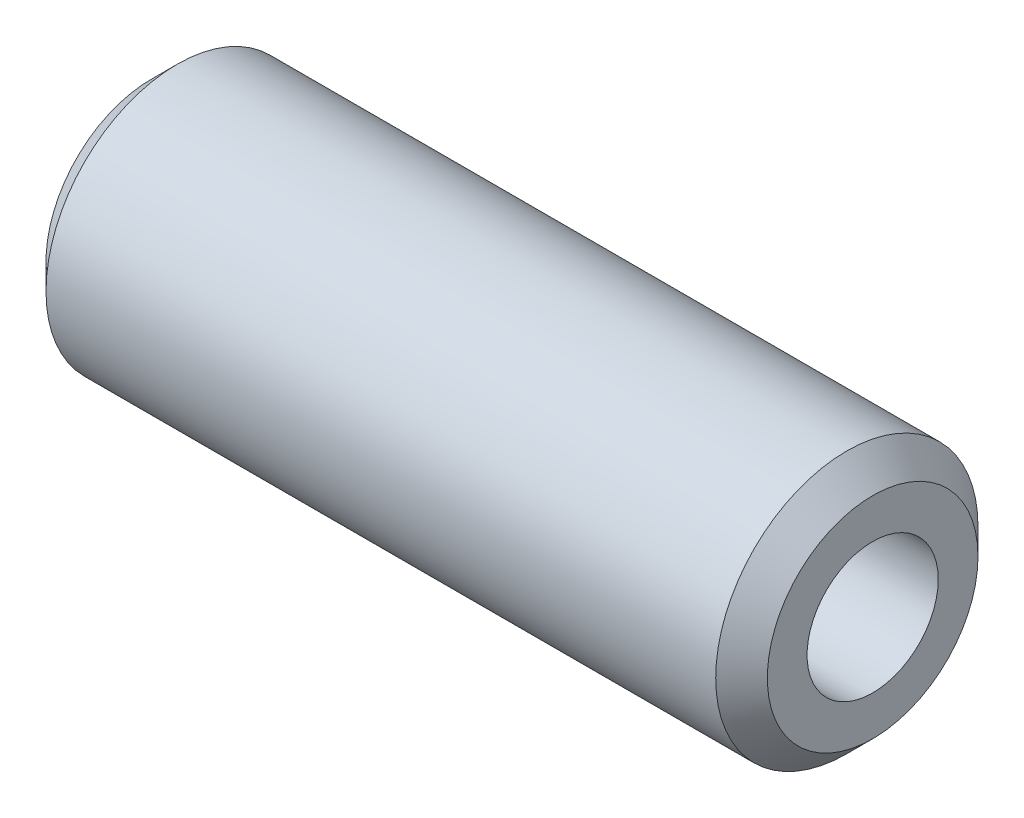
from build123d import *

# Parameters (mm, degrees)
SKETCH1_R           = 12.7
SKETCH1_R_2         = 6.35
BOSS_EXTRUDE1_DEPTH = 69.85
CHAMFER1_SIZE       = 2.5


with BuildPart() as part:
    # Sketch1 → Boss-Extrude1 (new body)
    with BuildSketch(Plane(origin=(0, 0, 0), x_dir=(0, 0, -1), z_dir=(1, 0, 0))):
        Circle(SKETCH1_R)
        Circle(SKETCH1_R_2, mode=Mode.SUBTRACT)
    extrude(amount=BOSS_EXTRUDE1_DEPTH)

    # Chamfer1
    chamfer1_edges = [part.edges().sort_by_distance(p)[0] for p in [
        (0, 0, 12.7),
        (69.85, 0, 12.7),
    ]]
    chamfer(chamfer1_edges, length=CHAMFER1_SIZE)


solid = part.part
